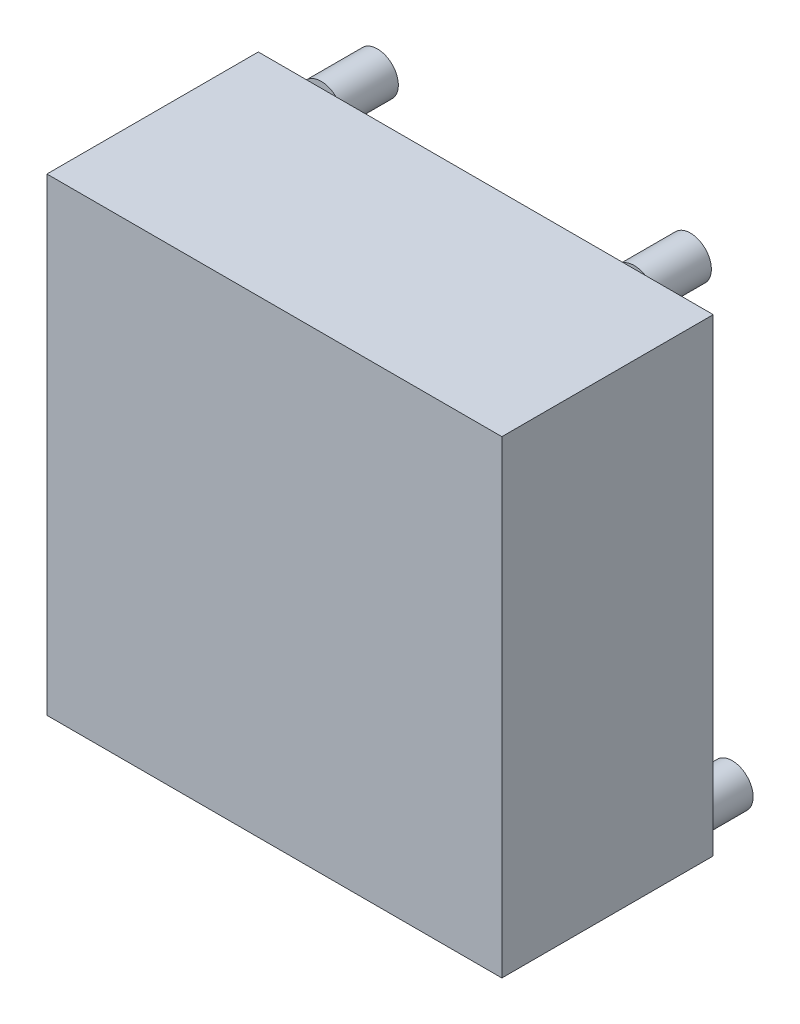
from build123d import *

# Parameters (mm, degrees)
SKETCH1_W           = 77.5208
SKETCH1_H           = 79.883
BOSS_EXTRUDE1_DEPTH = 36.0172
SKETCH4_R           = 3.5687
BOSS_EXTRUDE2_DEPTH = 9.5758
SKETCH5_R           = 3.5687
BOSS_EXTRUDE3_DEPTH = 9.5758
SKETCH6_R           = 1.3462
CUT_EXTRUDE1_DEPTH  = 8.636


with BuildPart() as part:
    # Sketch1 → Boss-Extrude1 (new body)
    with BuildSketch(Plane.XY):
        with Locations((38.7604, 39.9415)):
            Rectangle(SKETCH1_W, SKETCH1_H)
    extrude(amount=BOSS_EXTRUDE1_DEPTH)

    # Sketch4 → Boss-Extrude2 (add)
    with BuildSketch(Plane(origin=(0, 0, 0), x_dir=(-1, 0, 0), z_dir=(0, 0, -1))):
        with Locations(Location((-71.1708, 2.54, 0), (0, 0, 225.376971118))):
            Circle(SKETCH4_R)
        with Locations(Location((-3.0734, 2.452500211, 0), (0, 0, 223.410850824))):
            Circle(SKETCH4_R)
    extrude(amount=BOSS_EXTRUDE2_DEPTH)

    # Sketch5 → Boss-Extrude3 (add)
    with BuildSketch(Plane(origin=(0, 0, 0), x_dir=(-1, 0, 0), z_dir=(0, 0, -1))):
        with Locations(Location((-10.7188, 77.343, 0), (0, 0, 134.623028882))):
            Circle(SKETCH5_R)
        with Locations(Location((-64.0588, 76.835, 0), (0, 0, 121.340374815))):
            Circle(SKETCH5_R)
    extrude(amount=BOSS_EXTRUDE3_DEPTH)

    # Sketch6 → Cut-Extrude1 (cut)
    with BuildSketch(Plane(origin=(0, 0, -9.5758), x_dir=(-1, 0, 0), z_dir=(0, 0, -1))):
        with Locations((-71.1708, 2.54)):
            Circle(SKETCH6_R)
        with Locations((-3.0734, 2.452500211)):
            Circle(SKETCH6_R)
        with Locations((-10.7188, 77.343)):
            Circle(SKETCH6_R)
        with Locations((-64.0588, 76.835)):
            Circle(SKETCH6_R)
    extrude(amount=-CUT_EXTRUDE1_DEPTH, mode=Mode.SUBTRACT)


solid = part.part
